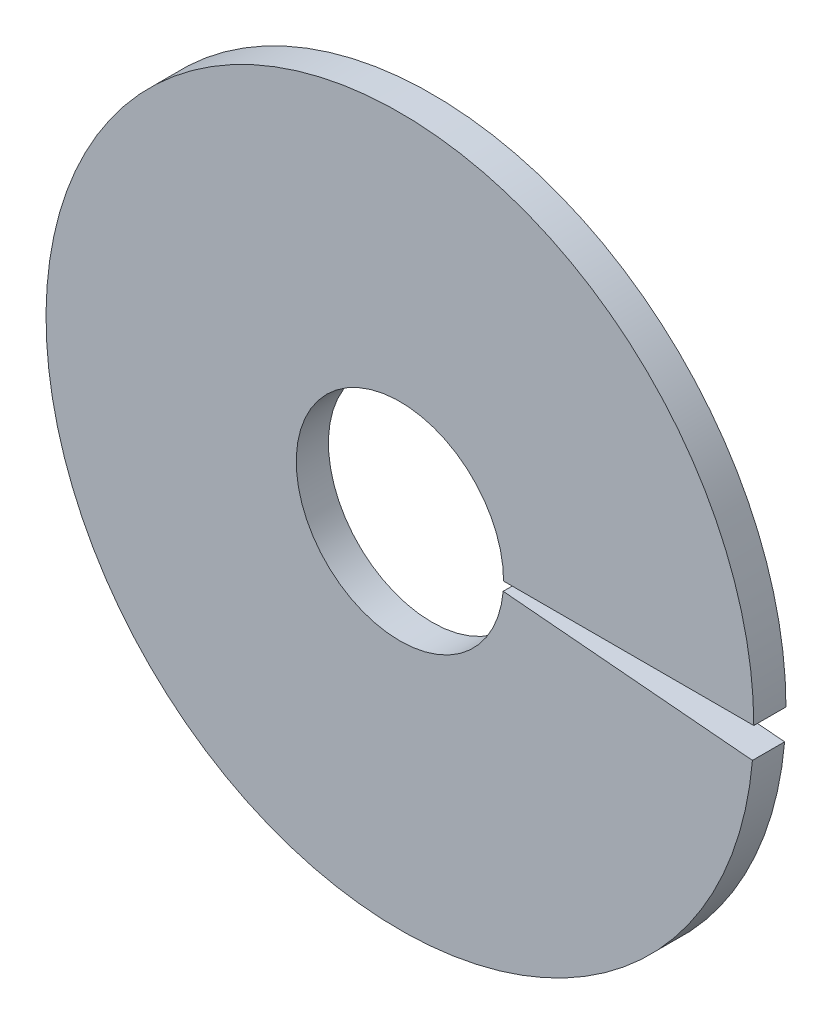
from build123d import *

# Parameters (mm, degrees)
SKETCH3_W      = 7
SKETCH3_H      = 0.9
REVOLVE1_ANGLE = 355


with BuildPart() as part:
    # Sketch3 → Revolve1 (revolve)
    with BuildSketch(Plane(origin=(0, 0, 0), x_dir=(1, 0, 0), z_dir=(0, 1, 0))):
        with Locations((6.4, 0.401281475)):
            Rectangle(SKETCH3_W, SKETCH3_H)
    revolve(axis=Axis((0, 0, -2.351581475), (0, 0, 1)), revolution_arc=REVOLVE1_ANGLE)


solid = part.part
